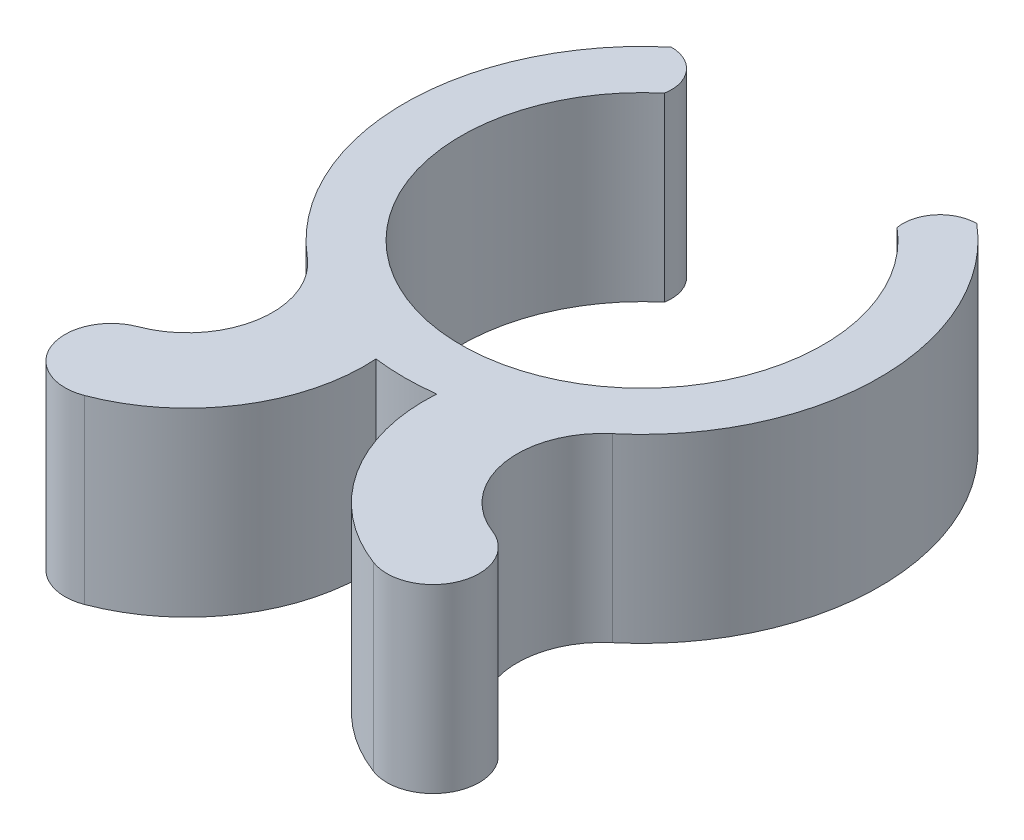
from build123d import *

# Parameters (mm, degrees)
BOSS_EXTRU_1_DEPTH = 8


with BuildPart() as part:
    # Esquisse4 → Boss.-Extru.1 (new body)
    with BuildSketch(Plane(origin=(0, 0, 0), x_dir=(1, 0, 0), z_dir=(0, 1, 0))):
        with BuildLine():
            ThreePointArc((-1.341955193, -10.413892464), (-1.552117835, -9.051281003), (-1.997724586, -7.746553845))
            ThreePointArc((-1.997724586, -7.746553845), (-7.802132308, -1.768256613), (-5.142300877, 6.128355545))
            ThreePointArc((-5.142300877, 6.128355545), (-5.499269902, 7.46058208), (-6.749269902, 8.043466653))
            ThreePointArc((-6.749269902, 8.043466653), (-10.5, 0), (-6.749269902, -8.043466653))
            ThreePointArc((-6.749269902, -8.043466653), (-4.215650663, -9.616563289), (-1.341955193, -10.413892464))
        make_face()
        with BuildLine():
            ThreePointArc((6.749269902, 8.043466653), (5.499269902, 7.46058208), (5.142300877, 6.128355545))
            ThreePointArc((5.142300877, 6.128355545), (7.11339354, -3.660550825), (-1.997724586, -7.746553845))
            ThreePointArc((-1.997724586, -7.746553845), (-1.552117835, -9.051281003), (-1.341955193, -10.413892464))
            ThreePointArc((-1.341955193, -10.413892464), (9.616563289, -4.215650663), (6.749269902, 8.043466653))
        make_face()
        with BuildLine():
            ThreePointArc((-6.389571855, -18.255279028), (-2.573158, -15.166655065), (-1.341955193, -10.413892464))
            ThreePointArc((-1.341955193, -10.413892464), (-4.215650663, -9.616563289), (-6.749269902, -8.043466653))
            ThreePointArc((-6.749269902, -8.043466653), (-5.459487684, -11.551992452), (-7.834566209, -14.438563679))
            ThreePointArc((-7.834566209, -14.438563679), (-9.020426707, -17.06941853), (-6.389571855, -18.255279028))
        make_face()
    boss_extru_1 = extrude(amount=BOSS_EXTRU_1_DEPTH)

    # Symétrie1: Boss.-Extru.1 across plane
    add(boss_extru_1.mirror(Plane(origin=(0, 0, 0), x_dir=(0, 0, 1), z_dir=(1, 0, 0))))


solid = part.part
